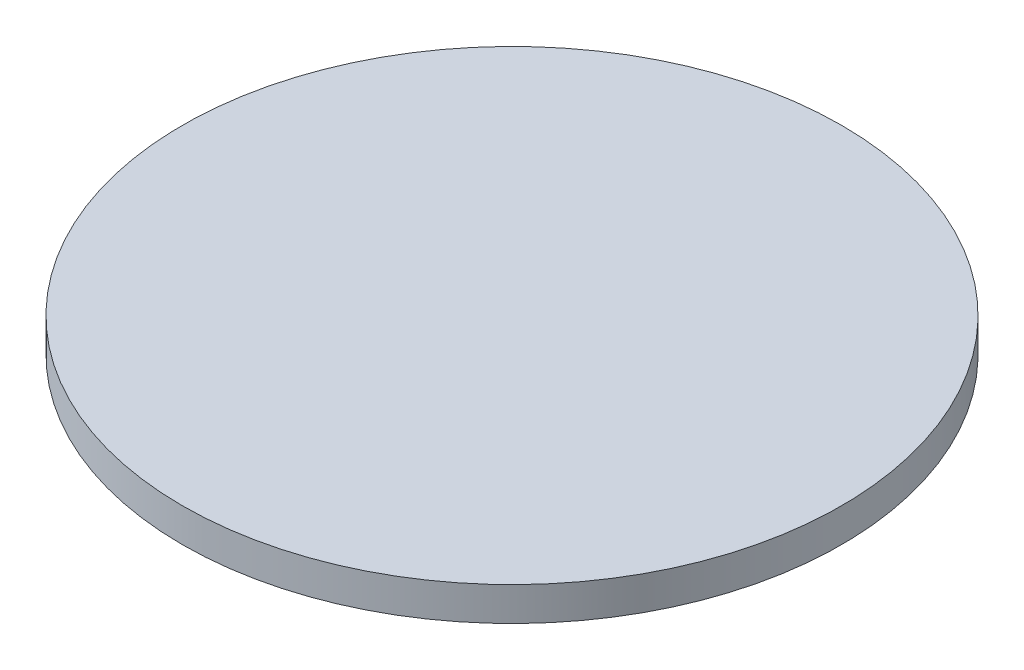
from build123d import *

# Parameters (mm, degrees)
ESQUISSE1_R        = 21.5
BOSS_EXTRU_1_DEPTH = 2.2


with BuildPart() as part:
    # Esquisse1 → Boss.-Extru.1 (new body)
    with BuildSketch(Plane(origin=(0, 0, 0), x_dir=(1, 0, 0), z_dir=(0, 1, 0))):
        with Locations(Location((0, 0, 0), (0, 0, 270))):
            Circle(ESQUISSE1_R)
    extrude(amount=BOSS_EXTRU_1_DEPTH)


solid = part.part
